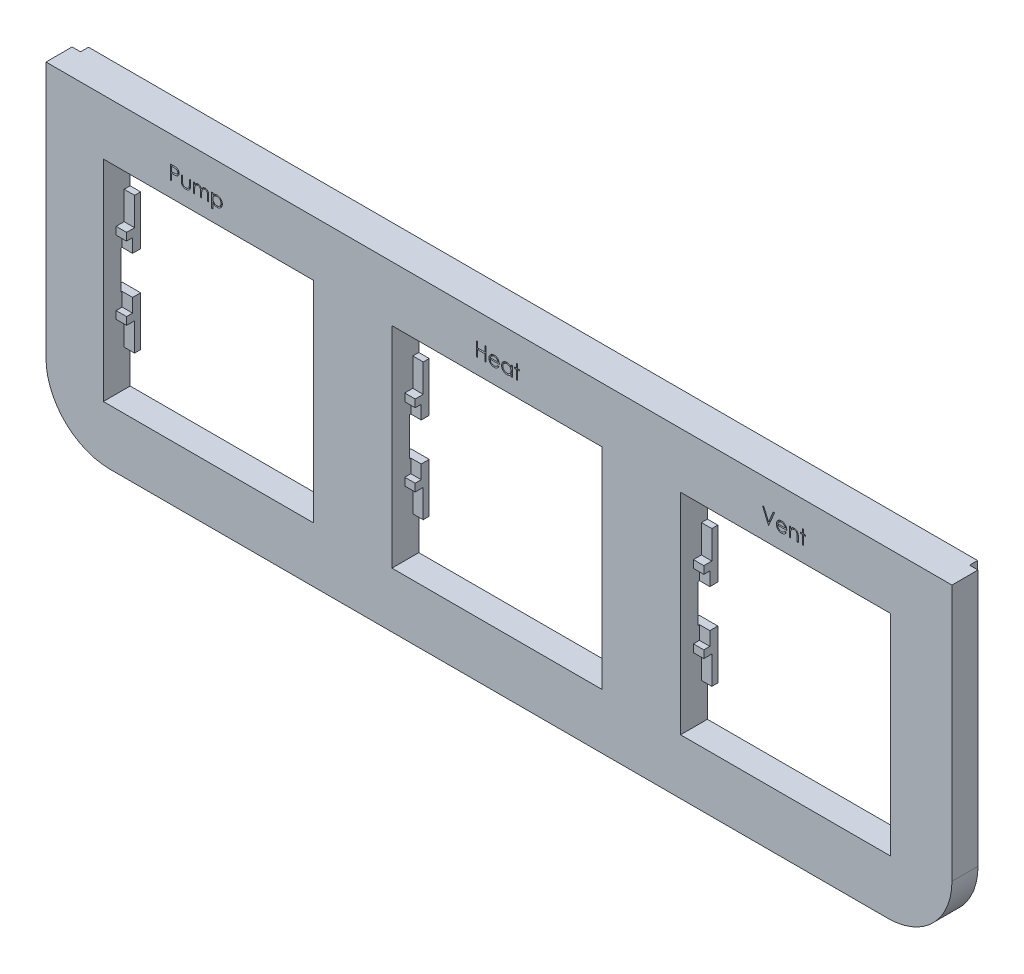
from build123d import *

# Parameters (mm, degrees)
SKETCH_1_W          = 226
SKETCH_1_H          = 80
EXTRUDE_1_DEPTH     = 6.5
SKETCH_2_W          = 221.8
SKETCH_2_H          = 77.9
EXTRUDE_2_DEPTH     = 2
SKETCH_3_W          = 52.4
SKETCH_3_H          = 52.4
CUT_EXTRUDE_1_DEPTH = 240.892163273
SKETCH_4_W          = 217.8
SKETCH_4_H          = 71.9
CUT_EXTRUDE_2_DEPTH = 5.5
EXTRUDE_START       = -3
SKETCH_5_W          = 56.4
SKETCH_5_H          = 56.4
SKETCH_5_W_2        = 52.4
SKETCH_5_H_2        = 52.4
EXTRUDE_3_DEPTH     = 6.7
SKETCH_6_W          = 2.6
SKETCH_6_H          = 12.3
EXTRUDE_4_DEPTH     = 1.5
EXTRUDE_START_2     = -1.5
SKETCH_7_W          = 2.6
SKETCH_7_H          = 5.3
EXTRUDE_5_DEPTH     = 2
EXTRUDE_START_3     = -2
SKETCH_8_W          = 2.6
SKETCH_8_H          = 1.9
EXTRUDE_6_DEPTH     = 3.5
SKETCH_9_W          = 200.4
SKETCH_9_H          = 9.5
CUT_EXTRUDE_3_DEPTH = 2.3
FILLET_1_R          = 15
FILLET_2_R          = 16
CUT_EXTRUDE_4_DEPTH = 0.6


with BuildPart() as part:
    # Эскиз1 → Бобышка-Вытянуть1 (new body)
    with BuildSketch(Plane.XY):
        with Locations((113, 40)):
            Rectangle(SKETCH_1_W, SKETCH_1_H)
    extrude(amount=EXTRUDE_1_DEPTH)

    # Эскиз2 → Бобышка-Вытянуть2 (add)
    with BuildSketch(Plane(origin=(0, 0, 0), x_dir=(-1, 0, 0), z_dir=(0, 0, -1))):
        with Locations((-113, 41.05)):
            Rectangle(SKETCH_2_W, SKETCH_2_H)
    extrude(amount=EXTRUDE_2_DEPTH)

    # Эскиз3 → Вырез-Вытянуть1 (cut, through all)
    with BuildSketch(Plane.XY.offset(6.5)):
        with Locations((40.5, 40)):
            Rectangle(SKETCH_3_W, SKETCH_3_H)
        with Locations((112.5, 40)):
            Rectangle(SKETCH_3_W, SKETCH_3_H)
        with Locations((184.5, 40)):
            Rectangle(SKETCH_3_W, SKETCH_3_H)
    extrude(amount=-CUT_EXTRUDE_1_DEPTH, mode=Mode.SUBTRACT)

    # Эскиз4 → Вырез-Вытянуть2 (cut)
    with BuildSketch(Plane(origin=(0, 0, -2), x_dir=(-1, 0, 0), z_dir=(0, 0, -1))):
        with Locations((-113, 40.05)):
            Rectangle(SKETCH_4_W, SKETCH_4_H)
    extrude(amount=-CUT_EXTRUDE_2_DEPTH, mode=Mode.SUBTRACT)

    # Эскиз5 → Бобышка-Вытянуть3 (add)
    # profile 1 of 3: a face of its own
    with BuildSketch(Plane(origin=(0, 0, 3.5), x_dir=(-1, 0, 0), z_dir=(0, 0, -1)).offset(EXTRUDE_START)):
        with Locations((-184.5, 40)):
            Rectangle(SKETCH_5_W, SKETCH_5_H)
        with Locations((-184.5, 40)):
            Rectangle(SKETCH_5_W_2, SKETCH_5_H_2, mode=Mode.SUBTRACT)
    # profile 2 of 3: a face of its own
    with BuildSketch(Plane(origin=(0, 0, 3.5), x_dir=(-1, 0, 0), z_dir=(0, 0, -1)).offset(EXTRUDE_START)):
        with Locations((-112.5, 40)):
            Rectangle(SKETCH_5_W, SKETCH_5_H)
        with Locations((-112.5, 40)):
            Rectangle(SKETCH_5_W_2, SKETCH_5_H_2, mode=Mode.SUBTRACT)
    # profile 3 of 3: a face of its own
    with BuildSketch(Plane(origin=(0, 0, 3.5), x_dir=(-1, 0, 0), z_dir=(0, 0, -1)).offset(EXTRUDE_START)):
        with Locations((-40.5, 40)):
            Rectangle(SKETCH_5_W, SKETCH_5_H)
        with Locations((-40.5, 40)):
            Rectangle(SKETCH_5_W_2, SKETCH_5_H_2, mode=Mode.SUBTRACT)
    extrude(amount=EXTRUDE_3_DEPTH)

    # Эскиз6 → Бобышка-Вытянуть4 (add)
    with BuildSketch(Plane(origin=(0, 0, -0.2), x_dir=(-1, 0, 0), z_dir=(0, 0, -1))):
        with Locations((-209.4, 29.1)):
            Rectangle(SKETCH_6_W, SKETCH_6_H)
        with Locations((-209.4, 50.9)):
            Rectangle(SKETCH_6_W, SKETCH_6_H)
        with Locations((-159.6, 29.1)):
            Rectangle(SKETCH_6_W, SKETCH_6_H)
        with Locations((-159.6, 50.9)):
            Rectangle(SKETCH_6_W, SKETCH_6_H)
        with Locations((-137.4, 29.1)):
            Rectangle(SKETCH_6_W, SKETCH_6_H)
        with Locations((-137.4, 50.9)):
            Rectangle(SKETCH_6_W, SKETCH_6_H)
        with Locations((-87.6, 29.1)):
            Rectangle(SKETCH_6_W, SKETCH_6_H)
        with Locations((-87.6, 50.9)):
            Rectangle(SKETCH_6_W, SKETCH_6_H)
        with Locations((-65.4, 29.1)):
            Rectangle(SKETCH_6_W, SKETCH_6_H)
        with Locations((-65.4, 50.9)):
            Rectangle(SKETCH_6_W, SKETCH_6_H)
        with Locations((-15.6, 29.1)):
            Rectangle(SKETCH_6_W, SKETCH_6_H)
        with Locations((-15.6, 50.9)):
            Rectangle(SKETCH_6_W, SKETCH_6_H)
    extrude(amount=-EXTRUDE_4_DEPTH)

    # Эскиз7 → Бобышка-Вытянуть5 (add)
    with BuildSketch(Plane.XY.offset(1.3).offset(EXTRUDE_START_2)):
        with Locations((209.4, 47.4)):
            Rectangle(SKETCH_7_W, SKETCH_7_H)
        with Locations((209.4, 32.6)):
            Rectangle(SKETCH_7_W, SKETCH_7_H)
        with Locations((159.6, 32.6)):
            Rectangle(SKETCH_7_W, SKETCH_7_H)
        with Locations((159.6, 47.4)):
            Rectangle(SKETCH_7_W, SKETCH_7_H)
        with Locations((137.4, 47.4)):
            Rectangle(SKETCH_7_W, SKETCH_7_H)
        with Locations((137.4, 32.6)):
            Rectangle(SKETCH_7_W, SKETCH_7_H)
        with Locations((87.6, 32.6)):
            Rectangle(SKETCH_7_W, SKETCH_7_H)
        with Locations((87.6, 47.4)):
            Rectangle(SKETCH_7_W, SKETCH_7_H)
        with Locations((65.4, 47.4)):
            Rectangle(SKETCH_7_W, SKETCH_7_H)
        with Locations((65.4, 32.6)):
            Rectangle(SKETCH_7_W, SKETCH_7_H)
        with Locations((15.6, 32.6)):
            Rectangle(SKETCH_7_W, SKETCH_7_H)
        with Locations((15.6, 47.4)):
            Rectangle(SKETCH_7_W, SKETCH_7_H)
    extrude(amount=EXTRUDE_5_DEPTH)

    # Эскиз8 → Бобышка-Вытянуть6 (add)
    with BuildSketch(Plane.XY.offset(1.8).offset(EXTRUDE_START_3)):
        with Locations((209.4, 30.9)):
            Rectangle(SKETCH_8_W, SKETCH_8_H)
        with Locations((209.4, 49.1)):
            Rectangle(SKETCH_8_W, SKETCH_8_H)
        with Locations((159.6, 30.9)):
            Rectangle(SKETCH_8_W, SKETCH_8_H)
        with Locations((159.6, 49.1)):
            Rectangle(SKETCH_8_W, SKETCH_8_H)
        with Locations((137.4, 30.9)):
            Rectangle(SKETCH_8_W, SKETCH_8_H)
        with Locations((137.4, 49.1)):
            Rectangle(SKETCH_8_W, SKETCH_8_H)
        with Locations((87.6, 30.9)):
            Rectangle(SKETCH_8_W, SKETCH_8_H)
        with Locations((87.6, 49.1)):
            Rectangle(SKETCH_8_W, SKETCH_8_H)
        with Locations((65.4, 30.9)):
            Rectangle(SKETCH_8_W, SKETCH_8_H)
        with Locations((65.4, 49.1)):
            Rectangle(SKETCH_8_W, SKETCH_8_H)
        with Locations((15.6, 30.9)):
            Rectangle(SKETCH_8_W, SKETCH_8_H)
        with Locations((15.6, 49.1)):
            Rectangle(SKETCH_8_W, SKETCH_8_H)
    extrude(amount=EXTRUDE_6_DEPTH)

    # Эскиз9 → Вырез-Вытянуть3 (cut)
    with BuildSketch(Plane(origin=(0, 0, -0.2), x_dir=(-1, 0, 0), z_dir=(0, 0, -1))):
        with Locations((-112.5, 40)):
            Rectangle(SKETCH_9_W, SKETCH_9_H)
    extrude(amount=-CUT_EXTRUDE_3_DEPTH, mode=Mode.SUBTRACT)

    # Скругление1
    fillet_1_edges = [part.edges().sort_by_distance(p)[0] for p in [
        (223.9, 2.1, -1),
        (2.1, 2.1, -1),
        (221.9, 4.1, 0.75),
        (4.1, 4.1, 0.75),
    ]]
    fillet(fillet_1_edges, radius=FILLET_1_R)

    # Скругление2
    fillet_2_edges = [part.edges().sort_by_distance(p)[0] for p in [
        (226, 0, 3.25),
        (0, 0, 3.25),
    ]]
    fillet(fillet_2_edges, radius=FILLET_2_R)

    # Эскиз10 → Вырез-Вытянуть4 (cut)
    # profile 1 of 12: a face of its own
    with BuildSketch(Plane.XY.offset(6.5)):
        Polygon((188.711538462, 73.58974359), (189.025641026, 73.58974359), (189.025641026, 72.557692308), (189.474358974, 72.557692308), (189.474358974, 72.243589744), (189.025641026, 72.243589744), (189.025641026, 70), (188.711538462, 70), (188.711538462, 72.243589744), (188.262820513, 72.243589744), (188.262820513, 72.557692308), (188.711538462, 72.557692308), align=None)
    # profile 2 of 12: a face of its own
    with BuildSketch(Plane.XY.offset(6.5)):
        with BuildLine():
            Line((185.435897436, 72.557692308), (185.75, 72.557692308))
            Line((185.75, 72.557692308), (185.75, 72.096354167))
            add(Edge.make_bspline(
                [(185.75, 72.096354167), (185.783537635, 72.13819689), (185.848618586, 72.219394153), (185.957002919, 72.326114728), (186.07154682, 72.414059953), (186.191548823, 72.484163747), (186.317171833, 72.537010373), (186.447650103, 72.575176304), (186.583764809, 72.598061132), (186.676329246, 72.601051363), (186.723157051, 72.602564103)],
                knots=[0, 0, 0, 0, 1.12780773, 2.188550248, 3.19190651, 4.159438251, 5.104880172, 6.052711206, 7.014878035, 8, 8, 8, 8], degree=3))
            add(Edge.make_bspline(
                [(186.723157051, 72.602564103), (186.770487685, 72.600818907), (186.863125153, 72.597403139), (186.998003215, 72.570386448), (187.123976608, 72.524241192), (187.240596164, 72.461029122), (187.345723377, 72.382422649), (187.438048229, 72.290844867), (187.514411476, 72.185508784), (187.565608839, 72.087785627), (187.599334487, 72.001096833), (187.620566824, 71.926850083), (187.638597806, 71.844131932), (187.654229554, 71.753192343), (187.664806666, 71.653394153), (187.673148957, 71.545146461), (187.679127652, 71.42848433), (187.679364859, 71.347797703), (187.679487179, 71.306189904)],
                knots=[0, 0, 0, 0, 1.235846778, 2.418850247, 3.575807741, 4.728682307, 5.871620074, 6.994088408, 8.11269785, 9.256955736, 9.865816715, 10.540099792, 11.271859618, 12.076849838, 12.949306005, 13.892391288, 14.913166135, 16, 16, 16, 16], degree=3))
            Line((187.679487179, 71.306189904), (187.679487179, 70))
            Line((187.679487179, 70), (187.365384615, 70))
            Line((187.365384615, 70), (187.365384615, 71.203125))
            add(Edge.make_bspline(
                [(187.365384615, 71.203125), (187.365191407, 71.237947445), (187.364821833, 71.304556856), (187.363656187, 71.399925879), (187.36084638, 71.486412457), (187.356898067, 71.563809825), (187.351119037, 71.632043661), (187.345096405, 71.691252938), (187.337731428, 71.74136248), (187.331168515, 71.771527563), (187.32822516, 71.78505609)],
                knots=[0, 0, 0, 0, 1.430800155, 2.736877192, 3.918605307, 4.986035426, 5.920637409, 6.731861385, 7.431261377, 8, 8, 8, 8], degree=3))
            add(Edge.make_bspline(
                [(187.32822516, 71.78505609), (187.317599629, 71.824767275), (187.297148768, 71.901199019), (187.246614785, 72.004873372), (187.182800604, 72.09307156), (187.104902755, 72.165248281), (187.013673679, 72.221419118), (186.909366536, 72.260393073), (186.792987896, 72.284769342), (186.711133513, 72.287196474), (186.668469551, 72.288461538)],
                knots=[0, 0, 0, 0, 1.084156227, 2.086665306, 3.027808233, 3.945421172, 4.874247719, 5.839848303, 6.874090471, 8, 8, 8, 8], degree=3))
            add(Edge.make_bspline(
                [(186.668469551, 72.288461538), (186.643201868, 72.287985534), (186.593197775, 72.287043533), (186.519047803, 72.277592235), (186.44712363, 72.262133779), (186.376703421, 72.241265142), (186.309195627, 72.212602873), (186.242431336, 72.180073502), (186.178924572, 72.13952529), (186.117321174, 72.094334669), (186.060008367, 72.044255462), (186.006680028, 71.991410952), (185.959142008, 71.935135348), (185.916073333, 71.8763354), (185.878895069, 71.814203562), (185.846441981, 71.749339256), (185.818906287, 71.681657107), (185.805223594, 71.634682046), (185.798377404, 71.611177885)],
                knots=[0, 0, 0, 0, 1.023777757, 2.026029729, 3.023749952, 4.003683103, 4.997618607, 5.993177895, 7.010360494, 8.046726602, 9.087585522, 10.09234134, 11.086953743, 12.070360549, 13.043493632, 14.017870808, 15.008233677, 16, 16, 16, 16], degree=3))
            add(Edge.make_bspline(
                [(185.798377404, 71.611177885), (185.794437755, 71.593922682), (185.785861346, 71.556359007), (185.776598167, 71.494714588), (185.768190591, 71.423404613), (185.761153633, 71.342512296), (185.756848216, 71.251754421), (185.752153819, 71.151518583), (185.750444758, 71.041405094), (185.750152404, 70.964743402), (185.75, 70.924779647)],
                knots=[0, 0, 0, 0, 0.615963638, 1.340920617, 2.168419149, 3.115676021, 4.16674242, 5.331190069, 6.6087489, 8, 8, 8, 8], degree=3))
            Line((185.75, 70.924779647), (185.75, 70))
            Line((185.75, 70), (185.435897436, 70))
            Line((185.435897436, 70), (185.435897436, 72.557692308))
        make_face()
    # profile 3 of 12: a face of its own
    with BuildSketch(Plane.XY.offset(6.5)):
        with BuildLine():
            Line((184.394030449, 70.807692308), (184.673076923, 70.661157853))
            add(Edge.make_bspline(
                [(184.673076923, 70.661157853), (184.650840328, 70.621714521), (184.607576719, 70.544973418), (184.533175971, 70.439541558), (184.455183899, 70.344693842), (184.370079931, 70.262964188), (184.280410252, 70.191712803), (184.185677597, 70.129374978), (184.085388779, 70.076256458), (183.979539055, 70.03150393), (183.867239503, 69.997094436), (183.748217987, 69.972790215), (183.622246492, 69.957766946), (183.535900312, 69.956021806), (183.491686699, 69.955128205)],
                knots=[0, 0, 0, 0, 1.120438281, 2.179929193, 3.190490725, 4.156257408, 5.095198341, 6.022838206, 6.959905092, 7.901321166, 8.864066838, 9.862729781, 10.905609505, 12, 12, 12, 12], degree=3))
            add(Edge.make_bspline(
                [(183.491686699, 69.955128205), (183.442544721, 69.95627538), (183.34668296, 69.958513187), (183.207143212, 69.977805652), (183.075763794, 70.00927801), (182.952552091, 70.053243552), (182.837809838, 70.110670876), (182.731308983, 70.180630358), (182.632489457, 70.262762612), (182.544465248, 70.357779056), (182.465221366, 70.459461013), (182.395295546, 70.565416898), (182.336838114, 70.675380122), (182.289285504, 70.788650646), (182.250880639, 70.90451454), (182.224113936, 71.024026007), (182.208684188, 71.146861592), (182.206319742, 71.229958927), (182.205128205, 71.271834936)],
                knots=[0, 0, 0, 0, 1.145258523, 2.234067595, 3.276747158, 4.290159414, 5.277019952, 6.260822364, 7.254936242, 8.264827045, 9.274100331, 10.257902744, 11.220704747, 12.172965371, 13.118907548, 14.062713208, 15.023725156, 16, 16, 16, 16], degree=3))
            add(Edge.make_bspline(
                [(182.205128205, 71.271834936), (182.206187346, 71.311129766), (182.208286425, 71.389006931), (182.221517212, 71.504272476), (182.244965505, 71.616300928), (182.277141829, 71.725185376), (182.318693075, 71.83074351), (182.369525295, 71.933039574), (182.429717672, 72.031964713), (182.476190346, 72.094367847), (182.499599359, 72.125801282)],
                knots=[0, 0, 0, 0, 1.024358464, 2.0301432, 3.019427413, 4.004406732, 4.986367066, 5.972626655, 6.978780325, 8, 8, 8, 8], degree=3))
            add(Edge.make_bspline(
                [(182.499599359, 72.125801282), (182.531307042, 72.163670152), (182.593717988, 72.238208303), (182.699274344, 72.336146628), (182.81357454, 72.418190404), (182.935186166, 72.48619754), (183.06552264, 72.537871187), (183.202831931, 72.576378769), (183.348677517, 72.59795678), (183.448382738, 72.601004614), (183.499399038, 72.602564103)],
                knots=[0, 0, 0, 0, 1.030682036, 2.02871468, 2.997146059, 3.962720338, 4.930598197, 5.918074684, 6.934738563, 8, 8, 8, 8], degree=3))
            add(Edge.make_bspline(
                [(183.499399038, 72.602564103), (183.551846644, 72.601210054), (183.65473689, 72.598553718), (183.804769011, 72.573927385), (183.946729727, 72.53487483), (184.080562232, 72.47972104), (184.206280092, 72.408561488), (184.323066142, 72.320419647), (184.432917654, 72.218001559), (184.496826233, 72.13923835), (184.529346955, 72.099158654)],
                knots=[0, 0, 0, 0, 1.056321875, 2.072262726, 3.055038591, 4.01806755, 4.982017516, 5.957941055, 6.960871419, 8, 8, 8, 8], degree=3))
            add(Edge.make_bspline(
                [(184.529346955, 72.099158654), (184.551473893, 72.068955072), (184.595580487, 72.008748954), (184.650827587, 71.910577797), (184.698784982, 71.807867202), (184.737117943, 71.698956905), (184.768157444, 71.585137325), (184.790614263, 71.46559478), (184.803783881, 71.340364869), (184.806372578, 71.255038314), (184.807692308, 71.211538462)],
                knots=[0, 0, 0, 0, 0.94817472, 1.890038105, 2.849395472, 3.817997239, 4.812318967, 5.836947057, 6.897266129, 8, 8, 8, 8], degree=3))
            Line((184.807692308, 71.211538462), (182.519230769, 71.211538462))
            add(Edge.make_bspline(
                [(182.519230769, 71.211538462), (182.520770376, 71.177837997), (182.52379795, 71.111567394), (182.537913093, 71.01459661), (182.560161867, 70.922223268), (182.591430929, 70.835140226), (182.629297774, 70.752210099), (182.675683491, 70.674048062), (182.731023045, 70.601010132), (182.792748745, 70.532442994), (182.86145584, 70.471382233), (182.933738587, 70.416730457), (183.010632152, 70.37092486), (183.091530236, 70.33374497), (183.176302021, 70.304638654), (183.264974216, 70.284770834), (183.357372332, 70.271463727), (183.420358066, 70.269984061), (183.452423878, 70.269230769)],
                knots=[0, 0, 0, 0, 1.094153842, 2.151609401, 3.174256925, 4.172055639, 5.149267565, 6.128595816, 7.11444997, 8.118368179, 9.117203808, 10.09244225, 11.054858984, 12.015122123, 12.976791628, 13.957293641, 14.960065497, 16, 16, 16, 16], degree=3))
            add(Edge.make_bspline(
                [(183.452423878, 70.269230769), (183.483775026, 70.269838826), (183.545981717, 70.271045327), (183.638622574, 70.282777238), (183.729762101, 70.301747513), (183.819023085, 70.327637504), (183.904593931, 70.359214356), (183.983839481, 70.397317213), (184.056719696, 70.43946696), (184.124836663, 70.487676635), (184.190907656, 70.546684822), (184.256450143, 70.620320543), (184.326726796, 70.707408071), (184.370716389, 70.772953737), (184.394030449, 70.807692308)],
                knots=[0, 0, 0, 0, 0.99110716, 1.966546729, 2.947904876, 3.932708344, 4.903319531, 5.828989031, 6.710028674, 7.56322171, 8.463672341, 9.504779593, 10.677557249, 12, 12, 12, 12], degree=3))
        make_face()
        with BuildLine():
            add(Edge.make_bspline(
                [(184.493589744, 71.525641026), (184.482093119, 71.567303899), (184.459965818, 71.64749152), (184.413729453, 71.75853241), (184.361657912, 71.857220311), (184.300036181, 71.942799944), (184.230217455, 72.018803457), (184.149572273, 72.085222043), (184.059136379, 72.144639494), (183.959377239, 72.194791993), (183.853735454, 72.237481852), (183.743129262, 72.266106968), (183.630271474, 72.28571651), (183.553937187, 72.287542618), (183.51552484, 72.288461538)],
                knots=[0, 0, 0, 0, 1.154881502, 2.222775134, 3.210006277, 4.132804581, 5.035138423, 5.962687519, 6.919655026, 7.923214229, 8.944639381, 9.960483929, 10.97369054, 12, 12, 12, 12], degree=3))
            add(Edge.make_bspline(
                [(183.51552484, 72.288461538), (183.484175401, 72.287849867), (183.422204152, 72.286640721), (183.330903084, 72.275170592), (183.243223385, 72.256210747), (183.158518097, 72.23024579), (183.077897229, 72.195637188), (182.999702461, 72.155053961), (182.925922065, 72.105512377), (182.879780769, 72.067753522), (182.856470353, 72.048677885)],
                knots=[0, 0, 0, 0, 1.04873581, 2.073130211, 3.073294108, 4.04793562, 5.032784715, 6.005352987, 6.992311501, 8, 8, 8, 8], degree=3))
            add(Edge.make_bspline(
                [(182.856470353, 72.048677885), (182.839777071, 72.033583569), (182.805993936, 72.003036353), (182.760853415, 71.950407146), (182.717632942, 71.893655584), (182.678299289, 71.83061046), (182.642221703, 71.761989681), (182.608461726, 71.688372045), (182.578075314, 71.609198915), (182.560979204, 71.554026476), (182.552183494, 71.525641026)],
                knots=[0, 0, 0, 0, 0.879870761, 1.780643979, 2.707998968, 3.669668524, 4.684282772, 5.740141944, 6.837334558, 8, 8, 8, 8], degree=3))
            Line((182.552183494, 71.525641026), (184.493589744, 71.525641026))
        make_face(mode=Mode.SUBTRACT)
    # profile 4 of 12: a face of its own
    with BuildSketch(Plane.XY.offset(6.5)):
        Polygon((178.75, 73.5), (179.086538462, 73.5), (180.253205128, 70.741786859), (181.419871795, 73.5), (181.756410256, 73.5), (180.275641026, 70), (180.230769231, 70), align=None)
    # profile 5 of 12: a face of its own
    with BuildSketch(Plane.XY.offset(6.5)):
        Polygon((117.365384615, 73.58974359), (117.679487179, 73.58974359), (117.679487179, 72.557692308), (118.128205128, 72.557692308), (118.128205128, 72.243589744), (117.679487179, 72.243589744), (117.679487179, 70), (117.365384615, 70), (117.365384615, 72.243589744), (116.916666667, 72.243589744), (116.916666667, 72.557692308), (117.365384615, 72.557692308), align=None)
    # profile 6 of 12: a face of its own
    with BuildSketch(Plane.XY.offset(6.5)):
        with BuildLine():
            Line((116.333333333, 72.557692308), (116.333333333, 70))
            Line((116.333333333, 70), (116.019230769, 70))
            Line((116.019230769, 70), (116.019230769, 70.442407853))
            add(Edge.make_bspline(
                [(116.019230769, 70.442407853), (115.983811979, 70.402368259), (115.914691763, 70.324230488), (115.799250645, 70.222148315), (115.676882467, 70.137769993), (115.548181146, 70.069620078), (115.413262903, 70.018428021), (115.272426816, 69.982041862), (115.125615435, 69.958648027), (115.02536308, 69.956312005), (114.974559295, 69.955128205)],
                knots=[0, 0, 0, 0, 1.074387032, 2.096679803, 3.090159297, 4.057316773, 5.018401886, 5.985159533, 6.978961417, 8, 8, 8, 8], degree=3))
            add(Edge.make_bspline(
                [(114.974559295, 69.955128205), (114.929391341, 69.956354577), (114.840318136, 69.958773038), (114.709289059, 69.977535341), (114.58319681, 70.007665963), (114.461922237, 70.049566853), (114.346250091, 70.105147674), (114.235189995, 70.171688922), (114.129317303, 70.250929752), (114.030245764, 70.341517781), (113.939013763, 70.439912768), (113.858952491, 70.544858315), (113.792199411, 70.655900619), (113.73637933, 70.771633773), (113.693382986, 70.892948692), (113.663409352, 71.01942586), (113.644668905, 71.150915734), (113.642251444, 71.240455257), (113.641025641, 71.285857372)],
                knots=[0, 0, 0, 0, 1.033919861, 2.038935746, 3.024066025, 3.998881131, 4.97069526, 5.957263378, 6.95902576, 7.993208707, 9.027059324, 10.027763471, 11.009749337, 11.988697705, 12.965288445, 13.950418724, 14.960734635, 16, 16, 16, 16], degree=3))
            add(Edge.make_bspline(
                [(113.641025641, 71.285857372), (113.642278612, 71.330321075), (113.644755669, 71.418223419), (113.663208889, 71.547502117), (113.694239898, 71.672020377), (113.737787745, 71.791377321), (113.7936297, 71.905717371), (113.861557787, 72.015121396), (113.941576912, 72.119890793), (114.033829319, 72.21756202), (114.133764089, 72.307782634), (114.24067282, 72.38619168), (114.351896102, 72.453908529), (114.469159112, 72.507562005), (114.590726217, 72.550971109), (114.717679663, 72.581004078), (114.849491241, 72.598701399), (114.938981733, 72.601264163), (114.984375, 72.602564103)],
                knots=[0, 0, 0, 0, 1.020392517, 2.01726096, 2.990465484, 3.961182959, 4.928053699, 5.906110375, 6.912531644, 7.948652711, 8.985773172, 9.998621852, 10.987621588, 11.969261332, 12.953316658, 13.946091881, 14.958173133, 16, 16, 16, 16], degree=3))
            add(Edge.make_bspline(
                [(114.984375, 72.602564103), (115.036574859, 72.601126351), (115.138936319, 72.598306988), (115.288664328, 72.574844261), (115.430308806, 72.535205794), (115.564963158, 72.481288296), (115.692143844, 72.409639567), (115.810646829, 72.319259606), (115.921712312, 72.210718419), (115.986092604, 72.127347974), (116.019230769, 72.084435096)],
                knots=[0, 0, 0, 0, 1.038897134, 2.037228247, 3.008116434, 3.962042015, 4.918381754, 5.904844433, 6.921570401, 8, 8, 8, 8], degree=3))
            Line((116.019230769, 72.084435096), (116.019230769, 72.557692308))
            Line((116.019230769, 72.557692308), (116.333333333, 72.557692308))
        make_face()
        with BuildLine():
            add(Edge.make_bspline(
                [(114.988581731, 72.288461538), (114.942667393, 72.286827901), (114.852039793, 72.28360336), (114.718995791, 72.258429865), (114.591682377, 72.21654527), (114.470736303, 72.159263369), (114.358068086, 72.087234632), (114.257374415, 72.000113249), (114.167831714, 71.900276235), (114.092523449, 71.788174125), (114.031132953, 71.667996033), (113.987965921, 71.542371595), (113.959496673, 71.413566618), (113.956588153, 71.326203932), (113.955128205, 71.282351763)],
                knots=[0, 0, 0, 0, 1.031046209, 2.035121221, 3.029706178, 4.034933723, 5.034054252, 6.02443088, 7.017295772, 8.038157696, 9.050218397, 10.03989886, 11.016116709, 12, 12, 12, 12], degree=3))
            add(Edge.make_bspline(
                [(113.955128205, 71.282351763), (113.956993098, 71.238761656), (113.960715575, 71.1517523), (113.98746627, 71.022771723), (114.032346143, 70.897117681), (114.093588206, 70.775856687), (114.170274831, 70.663272587), (114.259163483, 70.561532464), (114.361113764, 70.474042876), (114.474041272, 70.400805303), (114.594649242, 70.341642782), (114.721483173, 70.300477142), (114.852158812, 70.273899362), (114.941011145, 70.270794885), (114.985777244, 70.269230769)],
                knots=[0, 0, 0, 0, 0.979072187, 1.954306742, 2.945804271, 3.96968567, 4.997920485, 5.998718438, 6.996577872, 8.005894225, 9.015743152, 10.005417472, 10.995077863, 12, 12, 12, 12], degree=3))
            add(Edge.make_bspline(
                [(114.985777244, 70.269230769), (115.031223746, 70.270890733), (115.121612333, 70.274192237), (115.255051041, 70.299473502), (115.384546004, 70.3412423), (115.508333232, 70.399141427), (115.623649363, 70.470898783), (115.727147241, 70.554905874), (115.814663209, 70.652609058), (115.888855819, 70.759985511), (115.947031235, 70.877697508), (115.989407295, 71.003031698), (116.0144612, 71.135992447), (116.01761893, 71.226856374), (116.019230769, 71.273237179)],
                knots=[0, 0, 0, 0, 1.01762866, 2.023962475, 3.030623092, 4.058876274, 5.077231937, 6.066672613, 7.034107872, 8.005628644, 8.981990164, 9.965428785, 10.961468474, 12, 12, 12, 12], degree=3))
            add(Edge.make_bspline(
                [(116.019230769, 71.273237179), (116.018271113, 71.30857501), (116.016382205, 71.378131043), (116.001951636, 71.480258561), (115.978996709, 71.577992287), (115.946650539, 71.671434976), (115.904159255, 71.760069991), (115.852911489, 71.844533752), (115.792006039, 71.924386963), (115.722423343, 71.998530034), (115.646258141, 72.066156496), (115.5656636, 72.126520737), (115.479684853, 72.17610951), (115.389767816, 72.217150781), (115.295756482, 72.249809931), (115.196885862, 72.271597625), (115.094206875, 72.286557946), (115.02416082, 72.287820327), (114.988581731, 72.288461538)],
                knots=[0, 0, 0, 0, 1.050140795, 2.067009409, 3.05949893, 4.030605086, 5.00011959, 5.97591094, 6.962425594, 7.979863591, 8.993523472, 9.986985069, 10.967611495, 11.937549037, 12.921786183, 13.919465291, 14.943216303, 16, 16, 16, 16], degree=3))
        make_face(mode=Mode.SUBTRACT)
    # profile 7 of 12: a face of its own
    with BuildSketch(Plane.XY.offset(6.5)):
        with BuildLine():
            Line((112.688902244, 70.807692308), (112.967948718, 70.661157853))
            add(Edge.make_bspline(
                [(112.967948718, 70.661157853), (112.945712123, 70.621714521), (112.902448514, 70.544973418), (112.828047766, 70.439541558), (112.750055694, 70.344693842), (112.664951726, 70.262964188), (112.575282047, 70.191712803), (112.480549392, 70.129374978), (112.380260574, 70.076256458), (112.274410849, 70.03150393), (112.162111298, 69.997094436), (112.043089782, 69.972790215), (111.917118287, 69.957766946), (111.830772107, 69.956021806), (111.786558494, 69.955128205)],
                knots=[0, 0, 0, 0, 1.120438281, 2.179929193, 3.190490725, 4.156257408, 5.095198341, 6.022838206, 6.959905092, 7.901321166, 8.864066838, 9.862729781, 10.905609505, 12, 12, 12, 12], degree=3))
            add(Edge.make_bspline(
                [(111.786558494, 69.955128205), (111.737416516, 69.95627538), (111.641554754, 69.958513187), (111.502015007, 69.977805652), (111.370635589, 70.00927801), (111.247423886, 70.053243552), (111.132681633, 70.110670876), (111.026180778, 70.180630358), (110.927361252, 70.262762612), (110.839337043, 70.357779056), (110.76009316, 70.459461013), (110.69016734, 70.565416898), (110.631709909, 70.675380122), (110.584157299, 70.788650646), (110.545752434, 70.90451454), (110.51898573, 71.024026007), (110.503555982, 71.146861592), (110.501191537, 71.229958927), (110.5, 71.271834936)],
                knots=[0, 0, 0, 0, 1.145258523, 2.234067595, 3.276747158, 4.290159414, 5.277019952, 6.260822364, 7.254936242, 8.264827045, 9.274100331, 10.257902744, 11.220704747, 12.172965371, 13.118907548, 14.062713208, 15.023725156, 16, 16, 16, 16], degree=3))
            add(Edge.make_bspline(
                [(110.5, 71.271834936), (110.501059141, 71.311129766), (110.50315822, 71.389006931), (110.516389007, 71.504272476), (110.5398373, 71.616300928), (110.572013624, 71.725185376), (110.61356487, 71.83074351), (110.664397089, 71.933039574), (110.724589467, 72.031964713), (110.771062141, 72.094367847), (110.794471154, 72.125801282)],
                knots=[0, 0, 0, 0, 1.024358464, 2.0301432, 3.019427413, 4.004406732, 4.986367066, 5.972626655, 6.978780325, 8, 8, 8, 8], degree=3))
            add(Edge.make_bspline(
                [(110.794471154, 72.125801282), (110.826178837, 72.163670152), (110.888589783, 72.238208303), (110.994146139, 72.336146628), (111.108446335, 72.418190404), (111.230057961, 72.48619754), (111.360394435, 72.537871187), (111.497703726, 72.576378769), (111.643549312, 72.59795678), (111.743254533, 72.601004614), (111.794270833, 72.602564103)],
                knots=[0, 0, 0, 0, 1.030682036, 2.02871468, 2.997146059, 3.962720338, 4.930598197, 5.918074684, 6.934738563, 8, 8, 8, 8], degree=3))
            add(Edge.make_bspline(
                [(111.794270833, 72.602564103), (111.846718439, 72.601210054), (111.949608685, 72.598553718), (112.099640806, 72.573927385), (112.241601522, 72.53487483), (112.375434026, 72.47972104), (112.501151887, 72.408561488), (112.617937937, 72.320419647), (112.727789449, 72.218001559), (112.791698028, 72.13923835), (112.82421875, 72.099158654)],
                knots=[0, 0, 0, 0, 1.056321875, 2.072262726, 3.055038591, 4.01806755, 4.982017516, 5.957941055, 6.960871419, 8, 8, 8, 8], degree=3))
            add(Edge.make_bspline(
                [(112.82421875, 72.099158654), (112.846345688, 72.068955072), (112.890452281, 72.008748954), (112.945699381, 71.910577797), (112.993656776, 71.807867202), (113.031989737, 71.698956905), (113.063029239, 71.585137325), (113.085486057, 71.46559478), (113.098655676, 71.340364869), (113.101244373, 71.255038314), (113.102564103, 71.211538462)],
                knots=[0, 0, 0, 0, 0.94817472, 1.890038105, 2.849395472, 3.817997239, 4.812318967, 5.836947057, 6.897266129, 8, 8, 8, 8], degree=3))
            Line((113.102564103, 71.211538462), (110.814102564, 71.211538462))
            add(Edge.make_bspline(
                [(110.814102564, 71.211538462), (110.815642171, 71.177837997), (110.818669744, 71.111567394), (110.832784888, 71.01459661), (110.855033661, 70.922223268), (110.886302724, 70.835140226), (110.924169569, 70.752210099), (110.970555286, 70.674048062), (111.02589484, 70.601010132), (111.087620539, 70.532442994), (111.156327635, 70.471382233), (111.228610382, 70.416730457), (111.305503947, 70.37092486), (111.38640203, 70.33374497), (111.471173816, 70.304638654), (111.559846011, 70.284770834), (111.652244127, 70.271463727), (111.715229861, 70.269984061), (111.747295673, 70.269230769)],
                knots=[0, 0, 0, 0, 1.094153842, 2.151609401, 3.174256925, 4.172055639, 5.149267565, 6.128595816, 7.11444997, 8.118368179, 9.117203808, 10.09244225, 11.054858984, 12.015122123, 12.976791628, 13.957293641, 14.960065497, 16, 16, 16, 16], degree=3))
            add(Edge.make_bspline(
                [(111.747295673, 70.269230769), (111.778646821, 70.269838826), (111.840853512, 70.271045327), (111.933494369, 70.282777238), (112.024633896, 70.301747513), (112.11389488, 70.327637504), (112.199465726, 70.359214356), (112.278711276, 70.397317213), (112.351591491, 70.43946696), (112.419708458, 70.487676635), (112.485779451, 70.546684822), (112.551321938, 70.620320543), (112.621598591, 70.707408071), (112.665588184, 70.772953737), (112.688902244, 70.807692308)],
                knots=[0, 0, 0, 0, 0.99110716, 1.966546729, 2.947904876, 3.932708344, 4.903319531, 5.828989031, 6.710028674, 7.56322171, 8.463672341, 9.504779593, 10.677557249, 12, 12, 12, 12], degree=3))
        make_face()
        with BuildLine():
            add(Edge.make_bspline(
                [(112.788461538, 71.525641026), (112.776964914, 71.567303899), (112.754837612, 71.64749152), (112.708601248, 71.75853241), (112.656529707, 71.857220311), (112.594907976, 71.942799944), (112.52508925, 72.018803457), (112.444444068, 72.085222043), (112.354008174, 72.144639494), (112.254249033, 72.194791993), (112.148607248, 72.237481852), (112.038001056, 72.266106968), (111.925143269, 72.28571651), (111.848808982, 72.287542618), (111.810396635, 72.288461538)],
                knots=[0, 0, 0, 0, 1.154881502, 2.222775134, 3.210006277, 4.132804581, 5.035138423, 5.962687519, 6.919655026, 7.923214229, 8.944639381, 9.960483929, 10.97369054, 12, 12, 12, 12], degree=3))
            add(Edge.make_bspline(
                [(111.810396635, 72.288461538), (111.779047196, 72.287849867), (111.717075947, 72.286640721), (111.625774879, 72.275170592), (111.53809518, 72.256210747), (111.453389892, 72.23024579), (111.372769024, 72.195637188), (111.294574256, 72.155053961), (111.220793859, 72.105512377), (111.174652564, 72.067753522), (111.151342147, 72.048677885)],
                knots=[0, 0, 0, 0, 1.04873581, 2.073130211, 3.073294108, 4.04793562, 5.032784715, 6.005352987, 6.992311501, 8, 8, 8, 8], degree=3))
            add(Edge.make_bspline(
                [(111.151342147, 72.048677885), (111.134648865, 72.033583569), (111.100865731, 72.003036353), (111.05572521, 71.950407146), (111.012504737, 71.893655584), (110.973171084, 71.83061046), (110.937093498, 71.761989681), (110.903333521, 71.688372045), (110.872947109, 71.609198915), (110.855850999, 71.554026476), (110.847055288, 71.525641026)],
                knots=[0, 0, 0, 0, 0.879870761, 1.780643979, 2.707998968, 3.669668524, 4.684282772, 5.740141944, 6.837334558, 8, 8, 8, 8], degree=3))
            Line((110.847055288, 71.525641026), (112.788461538, 71.525641026))
        make_face(mode=Mode.SUBTRACT)
    # profile 8 of 12: a face of its own
    with BuildSketch(Plane.XY.offset(6.5)):
        Polygon((107.358974359, 73.5), (107.673076923, 73.5), (107.673076923, 72.064102564), (109.467948718, 72.064102564), (109.467948718, 73.5), (109.782051282, 73.5), (109.782051282, 70), (109.467948718, 70), (109.467948718, 71.705128205), (107.673076923, 71.705128205), (107.673076923, 70), (107.358974359, 70), align=None)
    # profile 9 of 12: a face of its own
    with BuildSketch(Plane.XY.offset(6.5)):
        with BuildLine():
            Line((41.307692308, 72.557692308), (41.621794872, 72.557692308))
            Line((41.621794872, 72.557692308), (41.621794872, 72.084435096))
            add(Edge.make_bspline(
                [(41.621794872, 72.084435096), (41.655152356, 72.12737283), (41.719975951, 72.210813723), (41.831700855, 72.318803851), (41.949627664, 72.409879155), (42.076791077, 72.481261688), (42.211214767, 72.5350825), (42.352347084, 72.57486195), (42.501385849, 72.598303424), (42.603282302, 72.601125086), (42.655248397, 72.602564103)],
                knots=[0, 0, 0, 0, 1.0828784, 2.104357462, 3.088488658, 4.04616522, 5.001424249, 5.969181776, 6.964304535, 8, 8, 8, 8], degree=3))
            add(Edge.make_bspline(
                [(42.655248397, 72.602564103), (42.700640001, 72.601250924), (42.790358889, 72.598655357), (42.922422118, 72.581082302), (43.049597501, 72.55096461), (43.171165555, 72.507563694), (43.288428621, 72.453908224), (43.39965072, 72.386191189), (43.506564276, 72.307784998), (43.606480465, 72.217552847), (43.698801833, 72.119924581), (43.778648014, 72.014902277), (43.847519918, 71.90593969), (43.903190215, 71.791347598), (43.946798562, 71.672028368), (43.97781324, 71.547499927), (43.996270883, 71.418223987), (43.998747335, 71.330321266), (44, 71.285857372)],
                knots=[0, 0, 0, 0, 1.041296284, 2.058176809, 3.050446431, 4.034000596, 5.01514041, 6.003636468, 7.015969324, 8.052561599, 9.08815499, 10.094063707, 11.074456064, 12.040834395, 13.011057502, 13.983766392, 14.980127149, 16, 16, 16, 16], degree=3))
            add(Edge.make_bspline(
                [(44, 71.285857372), (43.998774514, 71.240455063), (43.99635768, 71.150915159), (43.977612674, 71.019428062), (43.9476558, 70.892940688), (43.904597617, 70.771663424), (43.848956129, 70.655679773), (43.781251568, 70.545073377), (43.701365101, 70.439879674), (43.610063973, 70.341526774), (43.511011037, 70.250927461), (43.405133548, 70.171689391), (43.294074622, 70.105148016), (43.178402455, 70.049565056), (43.057126817, 70.007672872), (42.930813539, 69.977455071), (42.799531392, 69.958820576), (42.71023024, 69.956368433), (42.665064103, 69.955128205)],
                knots=[0, 0, 0, 0, 1.038740735, 2.04854663, 3.033179607, 4.009277356, 4.987731542, 5.972001279, 6.972200261, 8.005528982, 9.039189865, 10.040446548, 11.026516639, 11.997840187, 12.972163198, 13.956796175, 14.96660207, 16, 16, 16, 16], degree=3))
            add(Edge.make_bspline(
                [(42.665064103, 69.955128205), (42.614236531, 69.956423013), (42.513837175, 69.958980638), (42.367039504, 69.984900048), (42.225762652, 70.023636983), (42.091571828, 70.080335977), (41.963404015, 70.152591493), (41.841984209, 70.240701699), (41.726667456, 70.344482324), (41.657258699, 70.42321414), (41.621794872, 70.463441506)],
                knots=[0, 0, 0, 0, 1.014726462, 2.004382257, 2.969841629, 3.936926163, 4.907207904, 5.903978561, 6.929055279, 8, 8, 8, 8], degree=3))
            Line((41.621794872, 70.463441506), (41.621794872, 69.057692308))
            Line((41.621794872, 69.057692308), (41.307692308, 69.057692308))
            Line((41.307692308, 69.057692308), (41.307692308, 72.557692308))
        make_face()
        with BuildLine():
            add(Edge.make_bspline(
                [(42.65244391, 72.288461538), (42.616864348, 72.28782128), (42.54681736, 72.286560777), (42.444145141, 72.271586828), (42.345249713, 72.249849087), (42.251127762, 72.216937187), (42.160877145, 72.176538373), (42.075192981, 72.126056362), (41.994135413, 72.066404356), (41.917908383, 71.998725013), (41.849045089, 71.924150324), (41.788082161, 71.844562515), (41.736874856, 71.760062376), (41.694372836, 71.671437013), (41.662029553, 71.577991728), (41.639073833, 71.480258715), (41.624643481, 71.378131003), (41.622754543, 71.308574996), (41.621794872, 71.273237179)],
                knots=[0, 0, 0, 0, 1.05670511, 2.080379991, 3.077984906, 4.06214886, 5.038337365, 6.01289324, 7.01187578, 8.025460281, 9.038092164, 10.024533457, 11.000252242, 11.969694649, 12.940728589, 13.933144304, 14.949937299, 16, 16, 16, 16], degree=3))
            add(Edge.make_bspline(
                [(41.621794872, 71.273237179), (41.623385728, 71.226849067), (41.62650235, 71.135970826), (41.651839718, 71.003186704), (41.693074982, 70.877535048), (41.751603695, 70.760074011), (41.82555127, 70.652091176), (41.914649426, 70.55540057), (42.018091977, 70.470609979), (42.134159169, 70.399188725), (42.258581299, 70.341200659), (42.388367212, 70.299686448), (42.521732092, 70.27411422), (42.611900412, 70.270867401), (42.657351763, 70.269230769)],
                knots=[0, 0, 0, 0, 1.03728447, 2.032128127, 3.01272805, 3.987917167, 4.958271349, 5.931593992, 6.91984656, 7.941419022, 8.973179163, 9.983609215, 10.983593296, 12, 12, 12, 12], degree=3))
            add(Edge.make_bspline(
                [(42.657351763, 70.269230769), (42.701887531, 70.270787146), (42.790283024, 70.273876274), (42.920441145, 70.300614462), (43.046931784, 70.341459487), (43.167111956, 70.401019043), (43.279935444, 70.474009101), (43.381816997, 70.561569134), (43.470823911, 70.663059077), (43.546688266, 70.77606758), (43.607819751, 70.897242964), (43.653749991, 71.022624353), (43.680258565, 71.151769776), (43.684015353, 71.238767489), (43.685897436, 71.282351763)],
                knots=[0, 0, 0, 0, 1.00104056, 1.986885549, 2.97790532, 3.984399681, 4.995088187, 5.994304198, 6.996462723, 8.023150851, 9.048424203, 10.043036403, 11.019596776, 12, 12, 12, 12], degree=3))
            add(Edge.make_bspline(
                [(43.685897436, 71.282351763), (43.684442702, 71.326206752), (43.681544568, 71.413575056), (43.652997531, 71.542337959), (43.610097553, 71.668225935), (43.547538501, 71.787746484), (43.473337231, 71.900520567), (43.383590234, 72.000074446), (43.282974038, 72.087245119), (43.170284874, 72.159260529), (43.049344449, 72.216546024), (42.922029533, 72.258429663), (42.78898593, 72.283603412), (42.698358276, 72.286827918), (42.65244391, 72.288461538)],
                knots=[0, 0, 0, 0, 0.983928682, 1.960191568, 2.949917689, 3.96440592, 4.982380491, 5.975291189, 6.965713506, 7.964880129, 8.970154049, 9.96478489, 10.968906225, 12, 12, 12, 12], degree=3))
        make_face(mode=Mode.SUBTRACT)
    # profile 10 of 12: a face of its own
    with BuildSketch(Plane.XY.offset(6.5)):
        with BuildLine():
            Line((36.775641026, 72.557692308), (37.08974359, 72.557692308))
            Line((37.08974359, 72.557692308), (37.08974359, 72.11318109))
            add(Edge.make_bspline(
                [(37.08974359, 72.11318109), (37.11802754, 72.152068691), (37.172222299, 72.226581065), (37.261087952, 72.324771349), (37.349864064, 72.408099503), (37.413797446, 72.451842375), (37.444511218, 72.472856571)],
                knots=[0, 0, 0, 0, 1.134379233, 2.173579362, 3.122582517, 4, 4, 4, 4], degree=3))
            add(Edge.make_bspline(
                [(37.444511218, 72.472856571), (37.48637588, 72.492861936), (37.56937378, 72.532523149), (37.700793005, 72.572756708), (37.835267674, 72.597481809), (37.926075888, 72.600863183), (37.971754808, 72.602564103)],
                knots=[0, 0, 0, 0, 1.014936303, 2.012140481, 3.000054389, 4, 4, 4, 4], degree=3))
            add(Edge.make_bspline(
                [(37.971754808, 72.602564103), (38.002647804, 72.601518812), (38.063783383, 72.599450238), (38.154367473, 72.585990202), (38.242226085, 72.562724029), (38.326840115, 72.530316705), (38.406560794, 72.491070018), (38.479649992, 72.445020311), (38.5452742, 72.393323235), (38.603400251, 72.333644302), (38.655669276, 72.264307704), (38.703748123, 72.183443455), (38.748173335, 72.089235794), (38.772794644, 72.020869253), (38.785757212, 71.984875801)],
                knots=[0, 0, 0, 0, 1.009824226, 1.998387844, 2.986035974, 3.974953746, 4.955485308, 5.885931332, 6.793869504, 7.679848016, 8.601185859, 9.625726857, 10.749998409, 12, 12, 12, 12], degree=3))
            add(Edge.make_bspline(
                [(38.785757212, 71.984875801), (38.799468463, 72.009600221), (38.82645028, 72.058254406), (38.871755917, 72.127112668), (38.919223714, 72.19151946), (38.969258207, 72.251525884), (39.021682793, 72.306835614), (39.076744194, 72.357631516), (39.134128975, 72.40413173), (39.213921215, 72.458454889), (39.317733822, 72.516156071), (39.448621937, 72.566184515), (39.584772109, 72.597100643), (39.677189807, 72.600730916), (39.723858173, 72.602564103)],
                knots=[0, 0, 0, 0, 0.86119277, 1.694706429, 2.50939023, 3.298075842, 4.073795165, 4.829715201, 5.57930267, 6.321991688, 7.768977793, 9.186738141, 10.579381044, 12, 12, 12, 12], degree=3))
            add(Edge.make_bspline(
                [(39.723858173, 72.602564103), (39.766739636, 72.600946882), (39.850662822, 72.597781823), (39.972840088, 72.57292835), (40.086781893, 72.530250703), (40.192258969, 72.472017066), (40.287418783, 72.398837883), (40.370135092, 72.311769046), (40.439905455, 72.211426423), (40.485484095, 72.117034434), (40.516399359, 72.033699101), (40.535460593, 71.96269281), (40.552300289, 71.884541257), (40.566281534, 71.799150995), (40.576500086, 71.706220387), (40.584070801, 71.605901511), (40.589194875, 71.498116399), (40.589556947, 71.423750899), (40.58974359, 71.385416667)],
                knots=[0, 0, 0, 0, 1.209669288, 2.367440248, 3.500751976, 4.631527125, 5.755587489, 6.87532382, 8.007944318, 9.190864318, 9.82315674, 10.514484317, 11.263564316, 12.079023757, 12.955305781, 13.901327259, 14.918167583, 16, 16, 16, 16], degree=3))
            Line((40.58974359, 71.385416667), (40.58974359, 70))
            Line((40.58974359, 70), (40.275641026, 70))
            Line((40.275641026, 70), (40.275641026, 71.38681891))
            add(Edge.make_bspline(
                [(40.275641026, 71.38681891), (40.275563143, 71.419539484), (40.275413463, 71.482423451), (40.272719832, 71.572675902), (40.267644518, 71.654944259), (40.261709879, 71.729116348), (40.25346607, 71.795365136), (40.242820138, 71.853557555), (40.231542458, 71.904151366), (40.212806467, 71.960237414), (40.182858575, 72.022107624), (40.137241095, 72.0888312), (40.079770989, 72.146912), (40.013410832, 72.197330317), (39.937862388, 72.238323958), (39.854597665, 72.267599968), (39.764133613, 72.285722846), (39.701510825, 72.287528862), (39.669170673, 72.288461538)],
                knots=[0, 0, 0, 0, 1.253487763, 2.409012846, 3.458416907, 4.410876679, 5.259312806, 6.014470957, 6.676830364, 7.243083969, 8.276244668, 9.299465089, 10.325150304, 11.392391894, 12.482080715, 13.603491619, 14.762376348, 16, 16, 16, 16], degree=3))
            add(Edge.make_bspline(
                [(39.669170673, 72.288461538), (39.629500719, 72.287045381), (39.551097808, 72.284246516), (39.436652321, 72.255672643), (39.326681305, 72.212592392), (39.224466172, 72.150159935), (39.130438381, 72.075351571), (39.049538803, 71.986401975), (38.982706618, 71.885772048), (38.937452642, 71.792625346), (38.908863341, 71.708955902), (38.889986425, 71.63585853), (38.875303033, 71.552776962), (38.861532504, 71.460269472), (38.852544776, 71.357699291), (38.844376404, 71.24554089), (38.840555541, 71.123456931), (38.840021082, 71.038830242), (38.83974359, 70.994891827)],
                knots=[0, 0, 0, 0, 1.090531906, 2.155305635, 3.229839962, 4.33261226, 5.44038871, 6.529323825, 7.629011124, 8.757537029, 9.370236727, 10.061839251, 10.834451254, 11.692844982, 12.636905849, 13.66920014, 14.789842145, 16, 16, 16, 16], degree=3))
            Line((38.83974359, 70.994891827), (38.83974359, 70))
            Line((38.83974359, 70), (38.525641026, 70))
            Line((38.525641026, 70), (38.525641026, 71.300580929))
            add(Edge.make_bspline(
                [(38.525641026, 71.300580929), (38.525561595, 71.337274248), (38.525408777, 71.407868505), (38.52273246, 71.509102181), (38.517645838, 71.601183261), (38.51176529, 71.684004725), (38.503305112, 71.757416053), (38.493695349, 71.821810811), (38.482346739, 71.877027563), (38.463556854, 71.937590947), (38.434842386, 72.00431187), (38.388654124, 72.075452892), (38.331046544, 72.137720989), (38.263475668, 72.190879738), (38.187469986, 72.234821219), (38.103486585, 72.266480971), (38.012281672, 72.28490526), (37.949403966, 72.287253757), (37.917067308, 72.288461538)],
                knots=[0, 0, 0, 0, 1.320475261, 2.540461679, 3.643808994, 4.639130445, 5.527981419, 6.302341397, 6.981980563, 7.553956391, 8.582137848, 9.585246428, 10.591171744, 11.620968678, 12.668337649, 13.738356861, 14.836885341, 16, 16, 16, 16], degree=3))
            add(Edge.make_bspline(
                [(37.917067308, 72.288461538), (37.879051096, 72.286931078), (37.803286137, 72.283880926), (37.691984167, 72.256426652), (37.584498484, 72.213422577), (37.482543785, 72.153762758), (37.388869636, 72.07986368), (37.306861369, 71.992948784), (37.237918844, 71.89409975), (37.192187029, 71.801935234), (37.162688555, 71.720361959), (37.14309322, 71.651011011), (37.126253594, 71.574010763), (37.113739572, 71.489123652), (37.101659157, 71.396902558), (37.095828848, 71.296888068), (37.090157286, 71.18916598), (37.089884871, 71.114793435), (37.08974359, 71.076221955)],
                knots=[0, 0, 0, 0, 1.098833095, 2.189935336, 3.297829714, 4.440610912, 5.596351641, 6.740013378, 7.886572111, 9.072425424, 9.705826452, 10.395263256, 11.156850408, 11.985370555, 12.878090359, 13.847760091, 14.883794034, 16, 16, 16, 16], degree=3))
            Line((37.08974359, 71.076221955), (37.08974359, 70))
            Line((37.08974359, 70), (36.775641026, 70))
            Line((36.775641026, 70), (36.775641026, 72.557692308))
        make_face()
    # profile 11 of 12: a face of its own
    with BuildSketch(Plane.XY.offset(6.5)):
        with BuildLine():
            Line((33.769230769, 72.557692308), (34.083333333, 72.557692308))
            Line((34.083333333, 72.557692308), (34.083333333, 71.371394231))
            add(Edge.make_bspline(
                [(34.083333333, 71.371394231), (34.083475238, 71.336571482), (34.083746696, 71.269957194), (34.085587637, 71.174102007), (34.08991773, 71.086685294), (34.095331555, 71.007656557), (34.102293691, 70.937029166), (34.110577051, 70.875049809), (34.119835473, 70.821015625), (34.128898187, 70.788472269), (34.133112981, 70.77333734)],
                knots=[0, 0, 0, 0, 1.388932606, 2.656963016, 3.823490214, 4.879454478, 5.816252168, 6.653371382, 7.373723809, 8, 8, 8, 8], degree=3))
            add(Edge.make_bspline(
                [(34.133112981, 70.77333734), (34.139874436, 70.754314469), (34.153256777, 70.716664208), (34.177530261, 70.662275202), (34.207558597, 70.61189992), (34.240418425, 70.563595847), (34.278317833, 70.51879386), (34.320777304, 70.477569617), (34.366375541, 70.438365526), (34.434130564, 70.391980734), (34.52678983, 70.342265403), (34.648442585, 70.299369585), (34.780346811, 70.273733765), (34.871511531, 70.27075951), (34.918369391, 70.269230769)],
                knots=[0, 0, 0, 0, 0.725840625, 1.436591201, 2.137033971, 2.831655856, 3.53531722, 4.242432219, 4.957935707, 5.694543706, 7.190802206, 8.724350549, 10.316345118, 12, 12, 12, 12], degree=3))
            add(Edge.make_bspline(
                [(34.918369391, 70.269230769), (34.965222899, 70.270792018), (35.055875767, 70.273812745), (35.186330736, 70.298596284), (35.305582151, 70.340001973), (35.412433102, 70.397809384), (35.506398942, 70.468551447), (35.584703361, 70.551560256), (35.649310616, 70.644209643), (35.677520036, 70.713333922), (35.691706731, 70.748096955)],
                knots=[0, 0, 0, 0, 1.157059328, 2.238695713, 3.266970494, 4.264342957, 5.228770407, 6.160125903, 7.074715775, 8, 8, 8, 8], degree=3))
            add(Edge.make_bspline(
                [(35.691706731, 70.748096955), (35.695900961, 70.762063254), (35.705173379, 70.792939329), (35.715135731, 70.845319078), (35.724110192, 70.907783682), (35.731773368, 70.980741891), (35.737238531, 71.064003043), (35.740184558, 71.157541119), (35.743512833, 71.26106248), (35.743563349, 71.333530239), (35.743589744, 71.371394231)],
                knots=[0, 0, 0, 0, 0.557542046, 1.232589297, 2.036731608, 2.971723315, 4.038036528, 5.22795436, 6.551621927, 8, 8, 8, 8], degree=3))
            Line((35.743589744, 71.371394231), (35.743589744, 72.557692308))
            Line((35.743589744, 72.557692308), (36.057692308, 72.557692308))
            Line((36.057692308, 72.557692308), (36.057692308, 71.3125))
            add(Edge.make_bspline(
                [(36.057692308, 71.3125), (36.057250613, 71.270192829), (36.056393665, 71.188111129), (36.050886321, 71.068827017), (36.041436708, 70.957664772), (36.027094023, 70.854565552), (36.010228349, 70.759608071), (35.988472076, 70.672670625), (35.962493838, 70.594021071), (35.933188323, 70.522279294), (35.898566456, 70.4572324), (35.861739435, 70.395496583), (35.819214663, 70.338603648), (35.774444429, 70.283721511), (35.724642773, 70.233579983), (35.670742914, 70.187028507), (35.613503494, 70.143355476), (35.551654296, 70.104264196), (35.486098233, 70.069047551), (35.416754376, 70.037831473), (35.342773378, 70.013128896), (35.265109741, 69.99181823), (35.183382962, 69.975103761), (35.097671829, 69.963317194), (35.008005212, 69.956091863), (34.946895753, 69.955454818), (34.915564904, 69.955128205)],
                knots=[0, 0, 0, 0, 1.493040784, 2.896703357, 4.213163133, 5.428574705, 6.569057535, 7.615249723, 8.588095153, 9.490268104, 10.346124644, 11.18633936, 12.024365274, 12.850166724, 13.684164916, 14.514361689, 15.362232829, 16.222528818, 17.093394965, 17.986930858, 18.902426812, 19.842810585, 20.827885679, 21.843828298, 22.894529745, 24, 24, 24, 24], degree=3))
            add(Edge.make_bspline(
                [(34.915564904, 69.955128205), (34.88446839, 69.955467912), (34.823360845, 69.956135468), (34.7336896, 69.963277276), (34.647740994, 69.975085447), (34.565820596, 69.991940664), (34.487846198, 70.012979734), (34.413501958, 70.03798327), (34.343658395, 70.069063751), (34.277476391, 70.104041309), (34.215474003, 70.143606584), (34.157365425, 70.186974624), (34.103228573, 70.234080687), (34.053051505, 70.284728044), (34.007538528, 70.33954498), (33.966122486, 70.398090541), (33.928165781, 70.459784629), (33.893812991, 70.525847792), (33.864301235, 70.598419802), (33.838245989, 70.678716899), (33.816935351, 70.767619415), (33.799592883, 70.865051344), (33.785641442, 70.970546385), (33.7759553, 71.084714801), (33.770539469, 71.207278493), (33.769676408, 71.291928383), (33.769230769, 71.335637019)],
                knots=[0, 0, 0, 0, 1.083640291, 2.129454052, 3.13281866, 4.105697902, 5.042300162, 5.946461698, 6.836384745, 7.703652036, 8.553297018, 9.397182691, 10.228592656, 11.052265423, 11.879314572, 12.708807002, 13.549817954, 14.402308542, 15.300838682, 16.27712199, 17.341985831, 18.484375296, 19.725102775, 21.0496083, 22.476576903, 24, 24, 24, 24], degree=3))
            Line((33.769230769, 71.335637019), (33.769230769, 72.557692308))
        make_face()
    # profile 12 of 12: a face of its own
    with BuildSketch(Plane.XY.offset(6.5)):
        with BuildLine():
            Line((31.032051282, 73.5), (31.718449519, 73.5))
            add(Edge.make_bspline(
                [(31.718449519, 73.5), (31.765660425, 73.499948104), (31.856118618, 73.499848668), (31.985833674, 73.496833922), (32.103643406, 73.49280723), (32.209293786, 73.487225337), (32.303109885, 73.480628747), (32.384667184, 73.471376708), (32.45460674, 73.461716412), (32.49651319, 73.451895005), (32.515625, 73.447415865)],
                knots=[0, 0, 0, 0, 1.415646017, 2.712440637, 3.8905458, 4.950247383, 5.884950622, 6.709939814, 7.411656543, 8, 8, 8, 8], degree=3))
            add(Edge.make_bspline(
                [(32.515625, 73.447415865), (32.539818534, 73.440793916), (32.587635511, 73.427706054), (32.656536554, 73.40149233), (32.7220904, 73.370410165), (32.784521958, 73.334986225), (32.843064041, 73.293700661), (32.898590082, 73.248227043), (32.950610062, 73.197515475), (32.998831454, 73.142134735), (33.043116252, 73.083014525), (33.081245935, 73.019272295), (33.113173162, 72.951980992), (33.140556433, 72.881187421), (33.160264888, 72.806297097), (33.175111787, 72.727830385), (33.184535415, 72.645795695), (33.185437977, 72.589735827), (33.185897436, 72.561197917)],
                knots=[0, 0, 0, 0, 0.999701418, 1.975846123, 2.934577507, 3.890451536, 4.834027766, 5.787354733, 6.749476667, 7.726910423, 8.712836071, 9.690891519, 10.682875813, 11.679750201, 12.712814741, 13.765529915, 14.8625177, 16, 16, 16, 16], degree=3))
            add(Edge.make_bspline(
                [(33.185897436, 72.561197917), (33.185476011, 72.53242014), (33.184651465, 72.476114476), (33.17475518, 72.393741688), (33.161424988, 72.315023298), (33.140927936, 72.240133847), (33.114082263, 72.169518077), (33.08259021, 72.102096845), (33.04460668, 72.039017173), (33.00096185, 71.980050055), (32.952410256, 71.925140143), (32.899157317, 71.874685348), (32.841418025, 71.82898101), (32.779375877, 71.787924666), (32.712426028, 71.752468387), (32.641583874, 71.720711082), (32.566233658, 71.694040021), (32.514091144, 71.68000996), (32.487580128, 71.672876603)],
                knots=[0, 0, 0, 0, 1.121902311, 2.195077645, 3.232258892, 4.234102512, 5.217864754, 6.176164875, 7.132989551, 8.084763148, 9.034132444, 9.988522005, 10.94243251, 11.903244335, 12.886203696, 13.894208494, 14.929344452, 16, 16, 16, 16], degree=3))
            add(Edge.make_bspline(
                [(32.487580128, 71.672876603), (32.465652794, 71.668213621), (32.417597767, 71.657994427), (32.338455045, 71.64658597), (32.246309659, 71.63684837), (32.141287379, 71.629547232), (32.023482474, 71.623296864), (31.892831217, 71.61832877), (31.749077139, 71.615598916), (31.648805895, 71.615458123), (31.596454327, 71.615384615)],
                knots=[0, 0, 0, 0, 0.601384939, 1.31797006, 2.144135048, 3.087295005, 4.142315834, 5.309527816, 6.595305764, 8, 8, 8, 8], degree=3))
            Line((31.596454327, 71.615384615), (31.346153846, 71.615384615))
            Line((31.346153846, 71.615384615), (31.346153846, 70))
            Line((31.346153846, 70), (31.032051282, 70))
            Line((31.032051282, 70), (31.032051282, 73.5))
        make_face()
        with BuildLine():
            Line((31.346153846, 73.141025641), (31.346153846, 71.974358974))
            Line((31.346153846, 71.974358974), (31.958934295, 71.966646635))
            add(Edge.make_bspline(
                [(31.958934295, 71.966646635), (31.988854221, 71.966631171), (32.046614021, 71.966601319), (32.130050244, 71.970586542), (32.207459531, 71.975187075), (32.278604107, 71.981922998), (32.343516041, 71.991444256), (32.40230357, 72.001055994), (32.454510853, 72.014961356), (32.515610055, 72.033684426), (32.583693402, 72.065617041), (32.657760951, 72.111966931), (32.720531537, 72.17104764), (32.774849834, 72.237475471), (32.817955712, 72.3113746), (32.849511704, 72.390443537), (32.868052861, 72.473871387), (32.870539055, 72.530959525), (32.871794872, 72.559795673)],
                knots=[0, 0, 0, 0, 1.160613943, 2.240541288, 3.23993089, 4.169200891, 5.011653406, 5.7853311, 6.478053781, 7.106038997, 8.262395093, 9.384106736, 10.481365981, 11.59014053, 12.70357646, 13.786202915, 14.881775077, 16, 16, 16, 16], degree=3))
            add(Edge.make_bspline(
                [(32.871794872, 72.559795673), (32.870532225, 72.587934187), (32.86802224, 72.643870069), (32.849366377, 72.725848829), (32.818017063, 72.804084534), (32.774560469, 72.877057619), (32.721819339, 72.943246423), (32.660519996, 73.00074355), (32.590806734, 73.046965253), (32.525958503, 73.076798534), (32.468357317, 73.09501381), (32.418325357, 73.10775865), (32.361834683, 73.117934257), (32.298866903, 73.126173759), (32.22991007, 73.133227221), (32.154371755, 73.138013198), (32.072538111, 73.140814654), (32.015727541, 73.140953609), (31.986278045, 73.141025641)],
                knots=[0, 0, 0, 0, 1.120700087, 2.227813068, 3.331159281, 4.466773991, 5.599788987, 6.693661531, 7.80175334, 8.91857717, 9.525282508, 10.207424825, 10.974604443, 11.810962634, 12.737642355, 13.736264703, 14.826523623, 16, 16, 16, 16], degree=3))
            Line((31.986278045, 73.141025641), (31.346153846, 73.141025641))
        make_face(mode=Mode.SUBTRACT)
    extrude(amount=-CUT_EXTRUDE_4_DEPTH, mode=Mode.SUBTRACT)


solid = part.part
